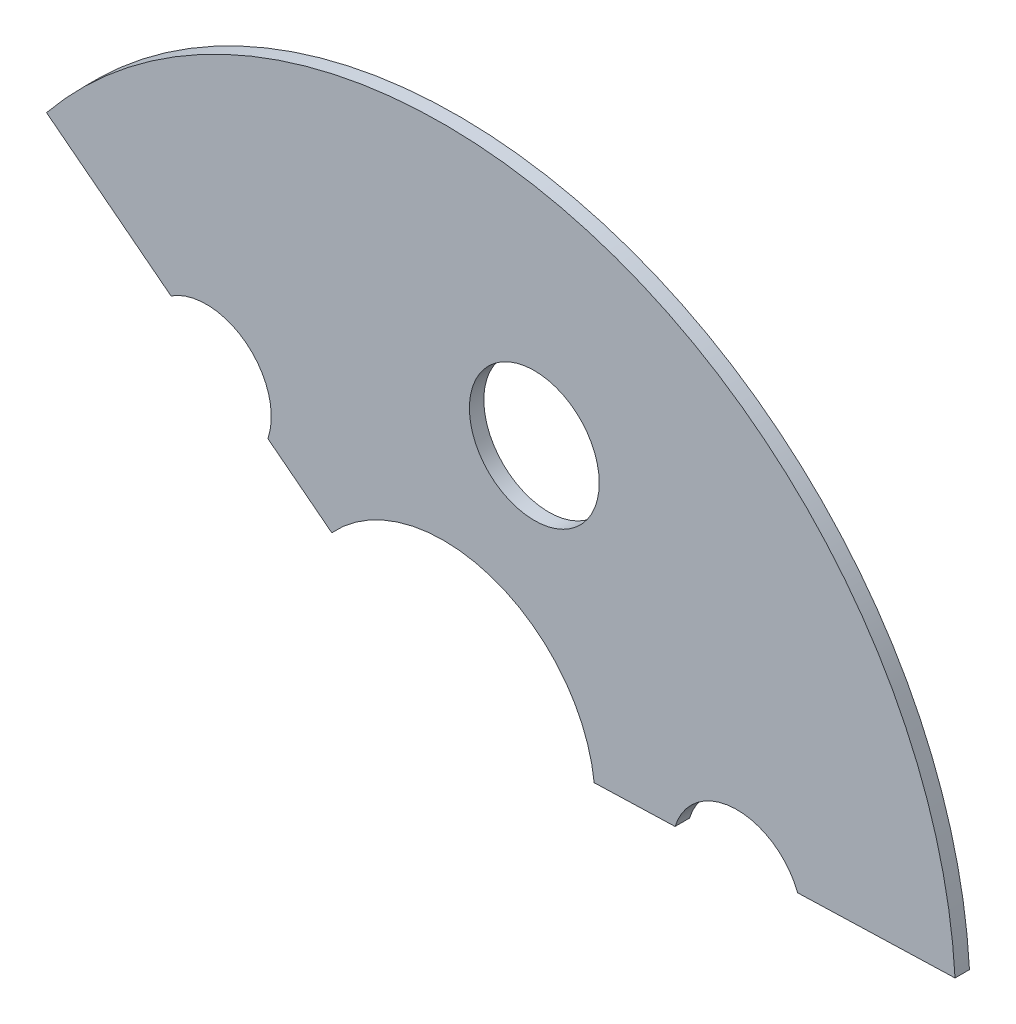
from build123d import *

# Parameters (mm, degrees)
BOSS_EXTRUDE1_DEPTH = 1.27
SKETCH15_R          = 5.715
CUT_EXTRUDE1_DEPTH  = 64.724190401


with BuildPart() as part:
    # Sketch13 → Boss-Extrude1 (new body)
    with BuildSketch(Plane.XY):
        with BuildLine():
            Line((-34.961025172, 28.467243349), (-9.847867764, 8.991202672))
            ThreePointArc((-9.847867764, 8.991202672), (4.12074162, 12.682338645), (13.251988711, 1.485604323))
            Line((13.251988711, 1.485604323), (45.016689319, 2.480908651))
            ThreePointArc((45.016689319, 2.480908651), (13.932031191, 42.878383037), (-34.961025172, 28.467243349))
        make_face()
    extrude(amount=BOSS_EXTRUDE1_DEPTH)

    # Sketch15 → Cut-Extrude1 (cut, through all)
    with BuildSketch(Plane.XY.offset(1.27)):
        with BuildLine():
            ThreePointArc((-15.475292944, 13.355447276), (-17.389315258, 19.694740336), (-24.005496972, 19.970887857))
            Line((-24.005496972, 19.970887857), (-15.475292944, 13.355447276))
        make_face()
        with Locations((7.979904528, 24.559620794)):
            Circle(SKETCH15_R)
        with BuildLine():
            ThreePointArc((31.159448366, 2.046710575), (25.644529482, 5.712196576), (20.369909931, 1.708634847))
            Line((20.369909931, 1.708634847), (31.159448366, 2.046710575))
        make_face()
    extrude(amount=-CUT_EXTRUDE1_DEPTH, mode=Mode.SUBTRACT)


solid = part.part
